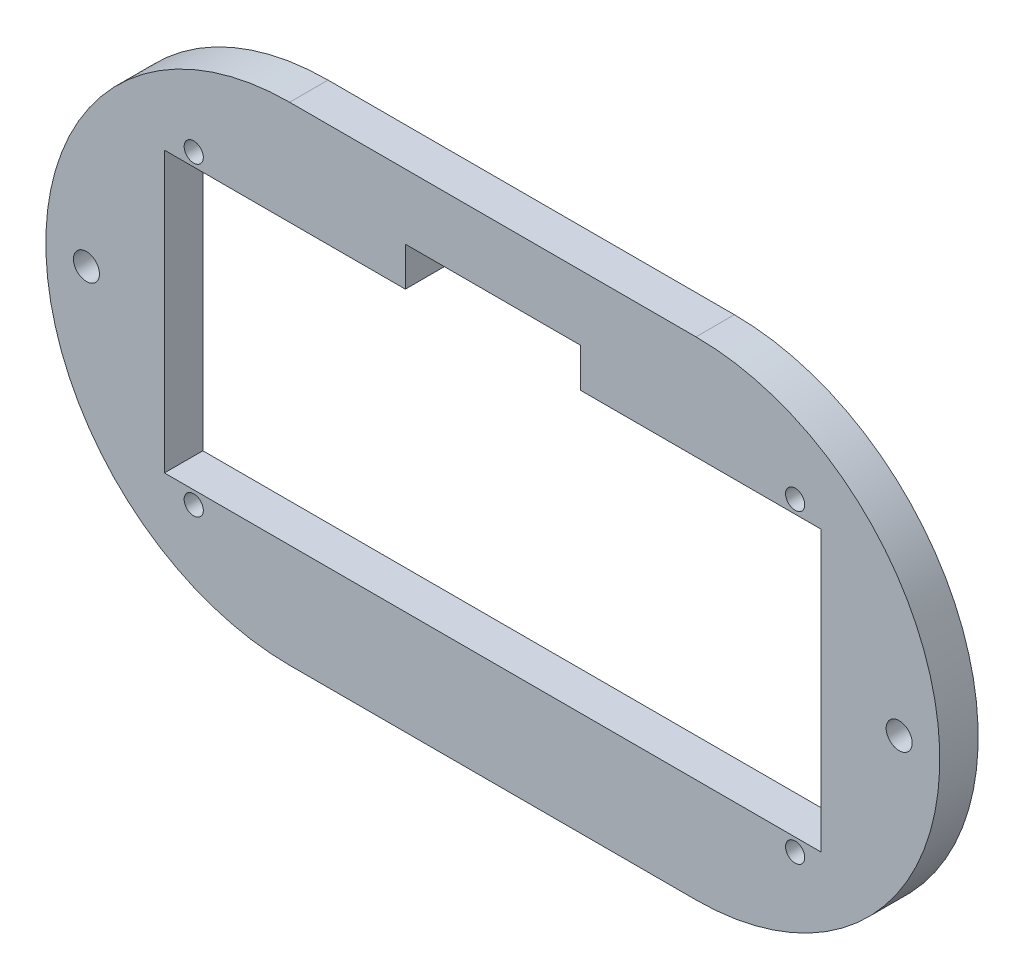
from build123d import *

# Parameters (mm, degrees)
SKETCH3_R           = 1.016
SKETCH3_R_2         = 0.75
BOSS_EXTRUDE1_DEPTH = 3


with BuildPart() as part:
    # Sketch3 → Boss-Extrude1 (new body)
    with BuildSketch(Plane.XY):
        with BuildLine():
            Line((9.525, -8.382), (41.275, -8.382))
            ThreePointArc((41.275, -8.382), (60.325, 10.668), (41.275, 29.718))
            Line((41.275, 29.718), (9.525, 29.718))
            ThreePointArc((9.525, 29.718), (-9.525, 10.668), (9.525, -8.382))
        make_face()
        with Locations((57.15, 10.668)):
            Circle(SKETCH3_R, mode=Mode.SUBTRACT)
        with Locations((-6.35, 10.668)):
            Circle(SKETCH3_R, mode=Mode.SUBTRACT)
        with Locations((2.032, 22.606)):
            Circle(SKETCH3_R_2, mode=Mode.SUBTRACT)
        with Locations((2.032, -1.27)):
            Circle(SKETCH3_R_2, mode=Mode.SUBTRACT)
        with Locations((49.022, -1.27)):
            Circle(SKETCH3_R_2, mode=Mode.SUBTRACT)
        with Locations((49.022, 22.606)):
            Circle(SKETCH3_R_2, mode=Mode.SUBTRACT)
        Polygon((18.5674, 24.638), (32.2326, 24.638), (32.2326, 21.59), (51.054, 21.59), (51.054, -0.254), (-0.254, -0.254), (-0.254, 21.59), (18.5674, 21.59), align=None, mode=Mode.SUBTRACT)
    extrude(amount=BOSS_EXTRUDE1_DEPTH)


solid = part.part
